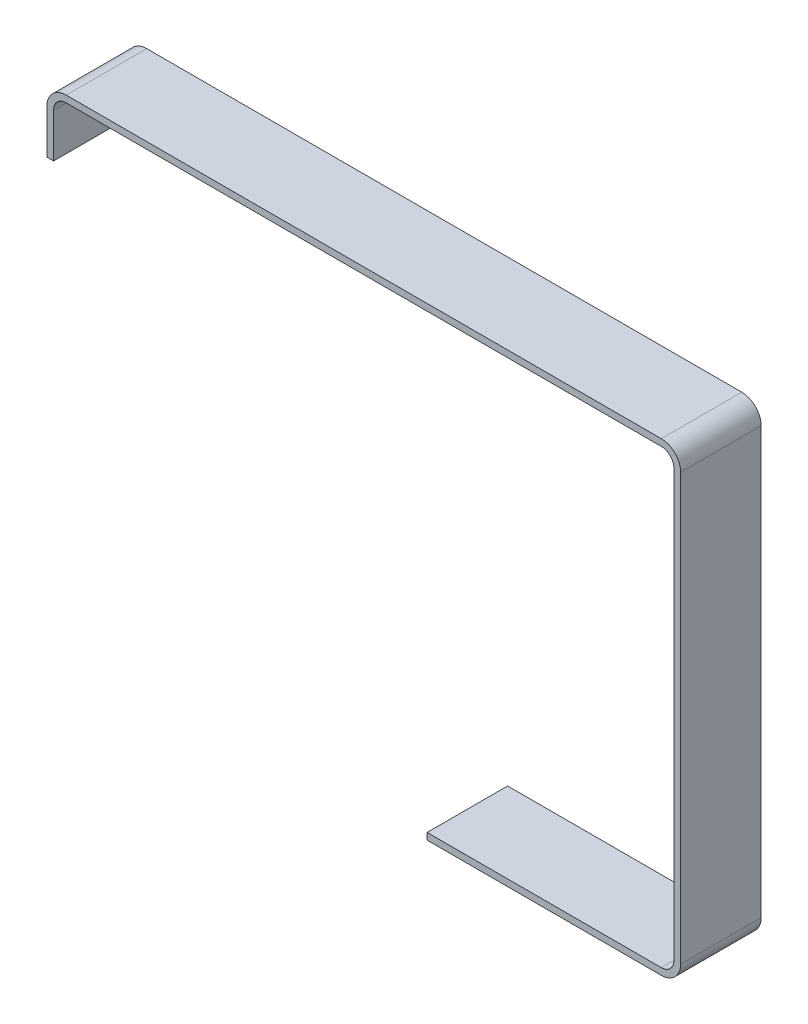
from build123d import *

# Parameters (mm, degrees)
BOSS_EXTRUDE1_DEPTH = 19.05
FILLET1_R           = 3
FILLET2_R           = 4.5875


with BuildPart() as part:
    # Sketch1 → Boss-Extrude1 (new body)
    with BuildSketch(Plane.XY):
        Polygon((-60, 0), (0, 0), (0, 110), (-150, 110), (-150, 95), (-148.4125, 95), (-148.4125, 108.4125), (-1.5875, 108.4125), (-1.5875, 1.5875), (-60, 1.5875), align=None)
    extrude(amount=BOSS_EXTRUDE1_DEPTH)

    # Fillet1
    fillet1_edges = [part.edges().sort_by_distance(p)[0] for p in [
        (-1.5875, 1.5875, 9.525),
        (-1.5875, 108.4125, 9.525),
        (-148.4125, 108.4125, 9.525),
    ]]
    fillet(fillet1_edges, radius=FILLET1_R)

    # Fillet2
    fillet2_edges = [part.edges().sort_by_distance(p)[0] for p in [
        (-150, 110, 9.525),
        (0, 110, 9.525),
        (0, 0, 9.525),
    ]]
    fillet(fillet2_edges, radius=FILLET2_R)


solid = part.part
